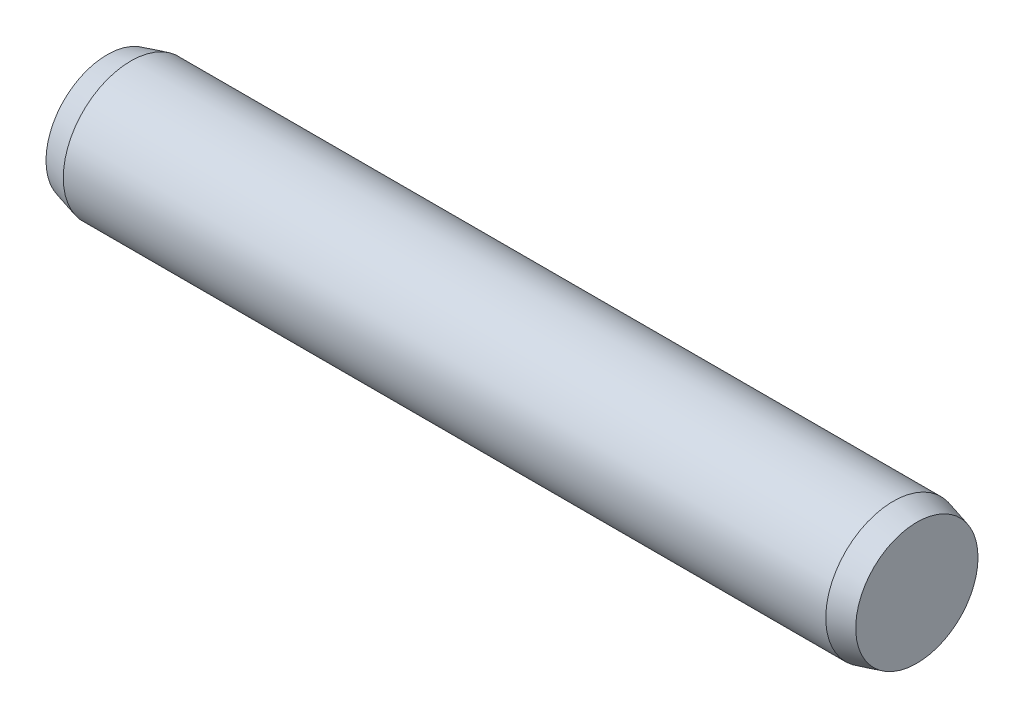
from build123d import *

# Parameters (mm, degrees)
EXTRUDE1_DEPTH      = 5.65
EXTRUDE1_DEPTH_BACK = 5.65
SKETCH2_R           = 1
SKETCH3_R           = 1
EXTRUDE2_DEPTH      = 0.35
EXTRUDE2_TAPER      = 15
SKETCH4_R           = 1
EXTRUDE3_DEPTH      = 0.35
EXTRUDE3_TAPER      = 15


with BuildPart() as part:
    # Sketch2 → Extrude1 (new, two sides: drawn at the far end of the back side and taken through both)
    with BuildSketch(Plane(origin=(0, 0, 0), x_dir=(0, 0, -1), z_dir=(1, 0, 0)).offset(-EXTRUDE1_DEPTH_BACK)):
        Circle(SKETCH2_R)
    extrude(amount=EXTRUDE1_DEPTH + EXTRUDE1_DEPTH_BACK)

    # Sketch3 → Extrude2 (add)
    with BuildSketch(Plane(origin=(5.65, 0, 0), x_dir=(0, 0, -1), z_dir=(1, 0, 0))):
        Circle(SKETCH3_R)
    extrude(amount=EXTRUDE2_DEPTH, taper=EXTRUDE2_TAPER)

    # Sketch4 → Extrude3 (add)
    with BuildSketch(Plane.ZY.offset(5.65)):
        with Locations(Location((0, 0, 0), (0, 0, 180))):
            Circle(SKETCH4_R)
    extrude(amount=EXTRUDE3_DEPTH, taper=EXTRUDE3_TAPER)


solid = part.part
